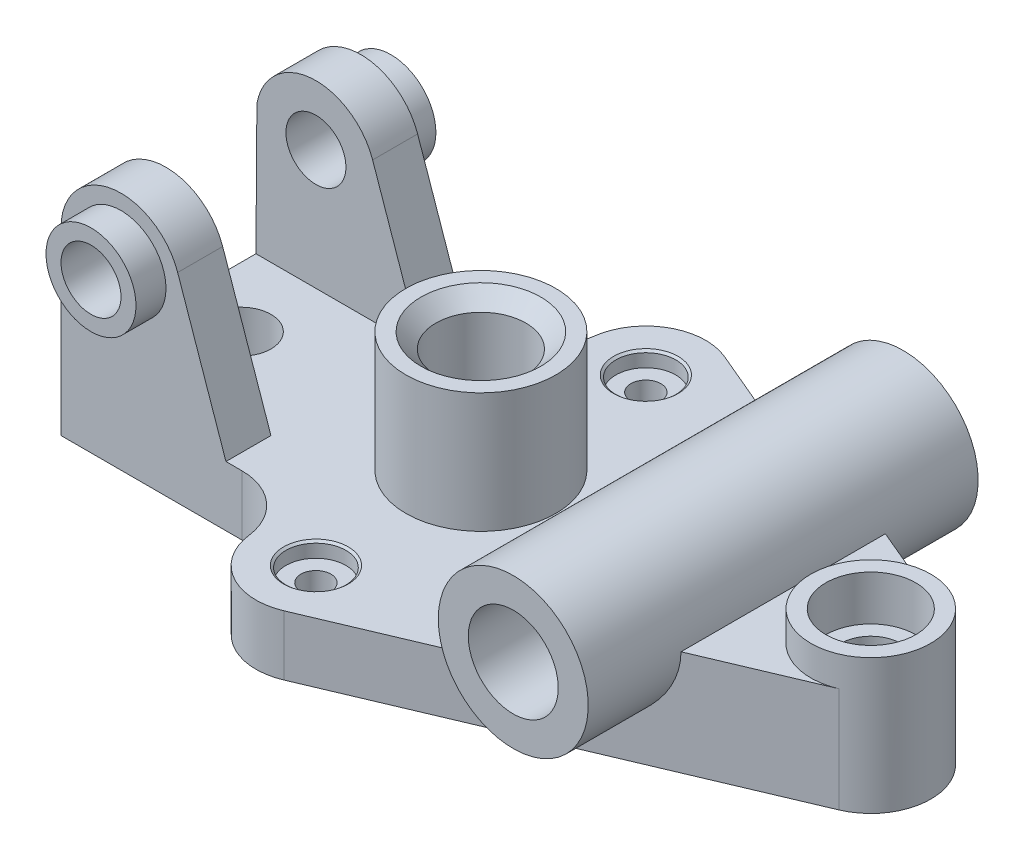
from build123d import *
from build123d.topology import SkipClean

# Parameters (mm, degrees)
SKETCH4_R                               = 10
BOSS_EXTRUDE1_DEPTH                     = 20
SKETCH5_R                               = 10
BOSS_EXTRUDE2_DEPTH                     = 15
BOSS_EXTRUDE4_START                     = 10
SKETCH6_R                               = 15
SKETCH6_R_2                             = 10
BOSS_EXTRUDE4_DEPTH                     = 10
BOSS_EXTRUDE6_START                     = -15
SKETCH10_R                              = 10
BOSS_EXTRUDE6_DEPTH                     = 15
SKETCH11_R                              = 15
SKETCH11_R_2                            = 10
BOSS_EXTRUDE7_DEPTH                     = 10
CBORE_FOR_M10_HEX_HEAD_BOLT2_AT_2_COUNT = 2
CBORE_FOR_M10_HEX_HEAD_BOLT2_AT_2_PITCH = 462.374719531
CBORE_FOR_M10_HEX_HEAD_BOLT2_AT_3_COUNT = 2
CBORE_FOR_M10_HEX_HEAD_BOLT2_AT_3_PITCH = 110
BOSS_EXTRUDE8_DEPTH                     = 40
BOSS_EXTRUDE8_DEPTH_BACK                = 35
SKETCH12_R                              = 25
SKETCH19_R                              = 20
BOSS_EXTRUDE9_DEPTH                     = 25
BOSS_EXTRUDE10_DEPTH                    = 15
BOSS_EXTRUDE14_DEPTH                    = 65
BOSS_EXTRUDE14_DEPTH_BACK               = 65
SKETCH28_R                              = 25
SKETCH29_R                              = 15
CUT_EXTRUDE2_DEPTH                      = 181


with BuildPart() as part:
    # Sketch4 → Boss-Extrude1 (new body)
    with BuildSketch(Plane(origin=(0, 0, 0), x_dir=(1, 0, 0), z_dir=(0, 1, 0))):
        with BuildLine():
            Line((-77.28011811, -56.673598022), (-77.28011811, 23.326401978))
            Line((-77.28011811, 23.326401978), (-16.966387776, 23.326401978))
            ThreePointArc((-16.966387776, 23.326401978), (-3.737631221, 28.326401978), (2.876747057, 40.826401978))
            ThreePointArc((2.876747057, 40.826401978), (12.736944948, 55.656750215), (30.512681706, 56.745747))
            Line((30.512681706, 56.745747), (160.512681706, 1.745747))
            ThreePointArc((160.512681706, 1.745747), (172.71988189, -16.673598022), (160.512681706, -35.092943043))
            Line((160.512681706, -35.092943043), (30.512681706, -90.092943043))
            ThreePointArc((30.512681706, -90.092943043), (12.736944948, -89.003946259), (2.876747057, -74.173598022))
            ThreePointArc((2.876747057, -74.173598022), (-3.737631221, -61.673598022), (-16.966387776, -56.673598022))
            Line((-16.966387776, -56.673598022), (-77.28011811, -56.673598022))
        make_face()
        with Locations((-57.28011811, -16.673598022)):
            Circle(SKETCH4_R, mode=Mode.SUBTRACT)
    extrude(amount=BOSS_EXTRUDE1_DEPTH)

    # Sketch5 → Boss-Extrude2 (add)
    with BuildSketch(Plane.XY.offset(56.673598022)):
        with BuildLine():
            Line((-77.28011811, 20), (-77.28011811, 60))
            ThreePointArc((-77.28011811, 60), (-60.595178298, 79.723345962), (-38.379080515, 66.538407896))
            Line((-38.379080515, 66.538407896), (-22.28011811, 20))
            Line((-22.28011811, 20), (-77.28011811, 20))
        make_face()
        with Locations((-57.28011811, 60)):
            Circle(SKETCH5_R, mode=Mode.SUBTRACT)
    extrude(amount=-BOSS_EXTRUDE2_DEPTH)

    # Sketch6 → Boss-Extrude4 (add)
    with BuildSketch(Plane.XY.offset(56.673598022).offset(BOSS_EXTRUDE4_START)):
        with Locations((-57.28011811, 60)):
            Circle(SKETCH6_R)
        with Locations((-57.28011811, 60)):
            Circle(SKETCH6_R_2, mode=Mode.SUBTRACT)
    extrude(amount=-BOSS_EXTRUDE4_DEPTH)

    # Sketch10 → Boss-Extrude6 (add)
    with BuildSketch(Plane(origin=(0, 0, -23.326401978), x_dir=(-1, 0, 0), z_dir=(0, 0, -1)).offset(BOSS_EXTRUDE6_START)):
        with BuildLine():
            Line((22.28011811, 20), (38.379080515, 66.538407896))
            ThreePointArc((38.379080515, 66.538407896), (58.842761472, 79.938860191), (76.96898439, 63.514049605))
            Line((76.96898439, 63.514049605), (77.28011811, 20))
            Line((77.28011811, 20), (22.28011811, 20))
        make_face()
        with Locations((57.28011811, 60)):
            Circle(SKETCH10_R, mode=Mode.SUBTRACT)
    extrude(amount=BOSS_EXTRUDE6_DEPTH)

    # Sketch11 → Boss-Extrude7 (add)
    with BuildSketch(Plane(origin=(0, 0, -23.326401978), x_dir=(-1, 0, 0), z_dir=(0, 0, -1))):
        with Locations((57.28011811, 60)):
            Circle(SKETCH11_R)
        with Locations((57.28011811, 60)):
            Circle(SKETCH11_R_2, mode=Mode.SUBTRACT)
    extrude(amount=BOSS_EXTRUDE7_DEPTH)

    # Sketch16 → CBORE for M10 Hex Head Bolt2 (revolve, cut)
    with BuildSketch(Plane(origin=(22.71988189, 20, 71.673598022), x_dir=(0, 0, 1), z_dir=(1, 0, 0))):
        Polygon((0, 0), (0, 20), (5, 20), (5, 5), (10, 5), (10, 0.639813469), (10.7625, 0), align=None)
    cbore_for_m10_hex_head_bolt2 = revolve(axis=Axis((22.71988189, 26.35, 71.673598022), (0, -1, 0)), mode=Mode.SUBTRACT)

    # CBORE for M10 Hex Head Bolt2 at 2: CBORE for M10 Hex Head Bolt2 ×2
    with Locations(*[Vector(-0.05491608922209683, 0, -0.9984909729910185) * (i * CBORE_FOR_M10_HEX_HEAD_BOLT2_AT_2_PITCH) for i in range(1, CBORE_FOR_M10_HEX_HEAD_BOLT2_AT_2_COUNT)]):
        add(cbore_for_m10_hex_head_bolt2, mode=Mode.SUBTRACT)

    # CBORE for M10 Hex Head Bolt2 at 3: CBORE for M10 Hex Head Bolt2 ×2
    with Locations(*[(0, 0, -i * CBORE_FOR_M10_HEX_HEAD_BOLT2_AT_3_PITCH) for i in range(1, CBORE_FOR_M10_HEX_HEAD_BOLT2_AT_3_COUNT)]):
        add(cbore_for_m10_hex_head_bolt2, mode=Mode.SUBTRACT)

    # Sketch12 → Boss-Extrude8 (add, two sides: drawn at the far end of the back side and taken through both)
    with BuildSketch(Plane(origin=(0, 20, 0), x_dir=(1, 0, 0), z_dir=(0, 1, 0)).offset(-BOSS_EXTRUDE8_DEPTH_BACK)):
        with Locations((22.71988189, -16.673598022)):
            Circle(SKETCH12_R)
    extrude(amount=BOSS_EXTRUDE8_DEPTH + BOSS_EXTRUDE8_DEPTH_BACK)

    # Sketch18 → CSK for M10 Countersunk Flat Head Screw1 (revolve, cut)
    with BuildSketch(Plane(origin=(22.71988189, 60, 16.673598022), x_dir=(0, 0, 1), z_dir=(1, 0, 0))):
        Polygon((0, 0), (0, 75), (20, 75), (15, 70), (15, 5), (20, 0), align=None)
    revolve(axis=Axis((22.71988189, 66.35, 16.673598022), (0, -1, 0)), mode=Mode.SUBTRACT)

    # Sketch19 → Boss-Extrude9 (add)
    with BuildSketch(Plane(origin=(0, 20, 0), x_dir=(1, 0, 0), z_dir=(0, 1, 0))):
        with Locations((152.71988189, -16.673598022)):
            Circle(SKETCH19_R)
    extrude(amount=BOSS_EXTRUDE9_DEPTH)

    # Sketch20 → CBORE for M10 Hex Head Bolt3 (revolve, cut)
    with SkipClean():  # the faces are left unmerged after this step: merging them gives an invalid solid
        with BuildSketch(Plane(origin=(152.71988189, 45, 16.673598022), x_dir=(0, 0, 1), z_dir=(1, 0, 0))):
            Polygon((0, 0), (0, 45), (20, 45), (10, 35), (10, 15), (15, 15), (15, 0), align=None)
        revolve(axis=Axis((152.71988189, 51.35, 16.673598022), (0, -1, 0)), mode=Mode.SUBTRACT)

    # Sketch23 → Boss-Extrude10 (add)
    with BuildSketch(Plane(origin=(0, 20, 0), x_dir=(1, 0, 0), z_dir=(0, 1, 0))):
        with BuildLine():
            ThreePointArc((160.512681706, -35.092943043), (132.71988189, -16.673598022), (160.512681706, 1.745747))
            Line((160.512681706, 1.745747), (72.71988189, 38.888854614))
            Line((72.71988189, 38.888854614), (72.71988189, -72.236050658))
            Line((72.71988189, -72.236050658), (160.512681706, -35.092943043))
        make_face()
    extrude(amount=BOSS_EXTRUDE10_DEPTH)

    # Sketch28 → Boss-Extrude14 (add, two sides: drawn at the far end of the back side and taken through both)
    with BuildSketch(Plane(origin=(0, 0, 16.673598022), x_dir=(-1, 0, 0), z_dir=(0, 0, -1)).offset(-BOSS_EXTRUDE14_DEPTH_BACK)):
        with Locations((-98.511863988, 35)):
            Circle(SKETCH28_R)
    extrude(amount=BOSS_EXTRUDE14_DEPTH + BOSS_EXTRUDE14_DEPTH_BACK)

    # Sketch29 → Cut-Extrude2 (cut)
    with BuildSketch(Plane(origin=(0, 0, -48.326401978), x_dir=(-1, 0, 0), z_dir=(0, 0, -1))):
        with Locations((-98.511863988, 35)):
            Circle(SKETCH29_R)
    extrude(amount=-CUT_EXTRUDE2_DEPTH, mode=Mode.SUBTRACT)


solid = part.part
